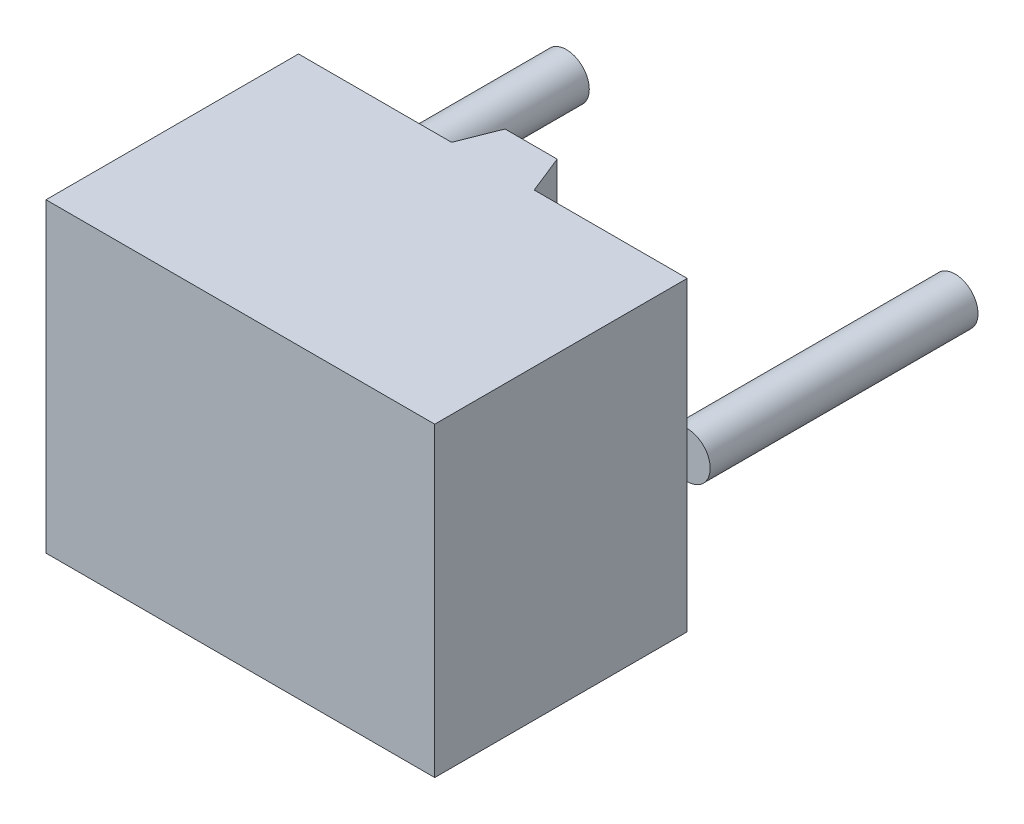
from build123d import *

# Parameters (mm, degrees)
EXTRUDE_1_DEPTH     = 3.8
CUT_EXTRUDE_1_DEPTH = 5.6
SKETCH_4_R          = 0.3
EXTRUDE_2_DEPTH     = 3
EXTRUDE_2_2_DEPTH   = 3
SKETCH_4_2_R        = 0.3
EXTRUDE_3_DEPTH     = 0.5


with BuildPart() as part:
    # Эскиз2 → Вытянуть1 (new body)
    with BuildSketch(Plane.XY):
        Polygon((2.54, -2), (0, -2), (0, 0), (0, 2), (2.54, 2), (5.08, 2), (5.08, 0), (5.08, -2), align=None)
    extrude(amount=EXTRUDE_1_DEPTH)

    # Эскиз3 → Вырез-Вытянуть1 (cut)
    with BuildSketch(Plane(origin=(0, 2, 0), x_dir=(-1, 0, 0), z_dir=(0, 1, 0))):
        Polygon((0, 0), (0, 0.5), (-2, 0.5), (-2.2, 0), align=None)
        Polygon((-2.88, 0), (-5.08, 0), (-5.08, 0.5), (-3.08, 0.5), align=None)
    extrude(amount=-CUT_EXTRUDE_1_DEPTH, mode=Mode.SUBTRACT)



with BuildPart() as body_2:
    # Эскиз4 → Вытянуть2 (new body)
    with BuildSketch(Plane.XY):
        Circle(SKETCH_4_R)
    extrude(amount=-EXTRUDE_2_DEPTH)


with BuildPart() as body_3:
    # Эскиз4 → Extrude 2 2 (new body)
    with BuildSketch(Plane.XY):
        with Locations(Location((5.08, 0, 0), (0, 0, 180))):
            Circle(SKETCH_4_R)
    extrude(amount=-EXTRUDE_2_2_DEPTH)


with BuildPart() as part_1:
    add(part.part)

    add(body_2.part)  # Вытянуть3 merges body 2

    add(body_3.part)  # Вытянуть3 merges body 3
    # Эскиз4<2> → Вытянуть3 (add)
    with BuildSketch(Plane.XY):
        with Locations(Location((0, 0, 0), (0, 0, 90))):
            Circle(SKETCH_4_2_R)
        with Locations(Location((5.08, 0, 0), (0, 0, 90))):
            Circle(SKETCH_4_2_R)
    extrude(amount=EXTRUDE_3_DEPTH)


solid = part_1.part
